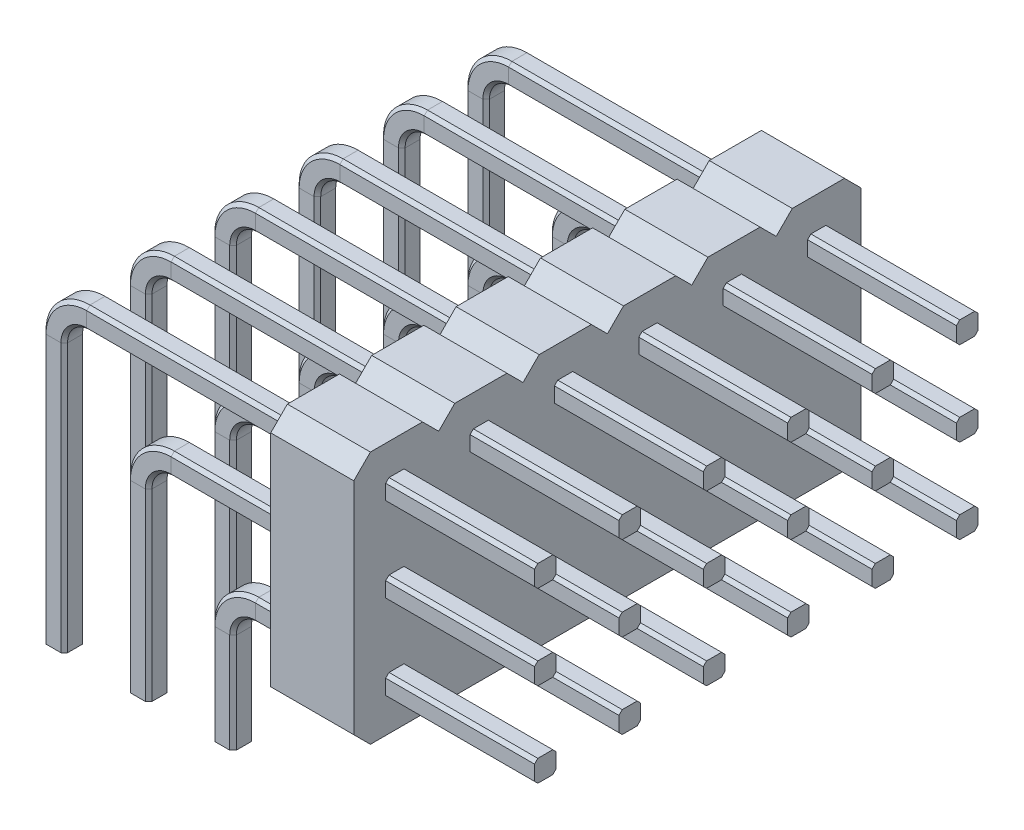
from build123d import *

# Parameters (mm, degrees)
EXTRUDE_1_DEPTH        = 2.5
PATTERN_LINEAR_1_COUNT = 6
PATTERN_LINEAR_1_PITCH = 2.54


with BuildPart() as part:
    # 扫描8: sweep along a path in 草图2
    with BuildLine(Plane.XY) as sweep_8_path:
        Line((5.08, 0), (5.08, 3))
        ThreePointArc((5.08, 3), (5.372893219, 3.707106781), (6.08, 4))
        Line((6.08, 4), (14.48, 4))
    # 草图1 → 扫描8 (sweep)
    with BuildSketch(Plane(origin=(0, 0, 0), x_dir=(1, 0, 0), z_dir=(0, 1, 0))):
        Polygon((5.405, -0.225), (5.405, 0.225), (5.305, 0.325), (4.855, 0.325), (4.755, 0.225), (4.755, -0.225), (4.855, -0.325), (5.305, -0.325), align=None)
    sweep(path=sweep_8_path.line)



with BuildPart() as body_2:
    # 扫描9: sweep along a path in 草图2<3>
    with BuildLine(Plane.XY) as sweep_9_path:
        Line((2.54, 0), (2.54, 5.54))
        ThreePointArc((2.54, 5.54), (2.832893219, 6.247106781), (3.54, 6.54))
        Line((3.54, 6.54), (14.48, 6.54))
    # 草图1<8> → 扫描9 (sweep)
    with BuildSketch(Plane(origin=(0, 0, 0), x_dir=(1, 0, 0), z_dir=(0, 1, 0))):
        Polygon((2.865, -0.225), (2.865, 0.225), (2.765, 0.325), (2.315, 0.325), (2.215, 0.225), (2.215, -0.225), (2.315, -0.325), (2.765, -0.325), align=None)
    sweep(path=sweep_9_path.line)


with BuildPart() as body_3:
    # 扫描10: sweep along a path in 草图2<4>
    with BuildLine(Plane.XY) as sweep_10_path:
        Line((0, 0), (0, 8.08))
        ThreePointArc((0, 8.08), (0.292893219, 8.787106781), (1, 9.08))
        Line((1, 9.08), (14.48, 9.08))
    # 草图1<9> → 扫描10 (sweep)
    with BuildSketch(Plane(origin=(0, 0, 0), x_dir=(1, 0, 0), z_dir=(0, 1, 0))):
        Polygon((-0.225, 0.325), (-0.325, 0.225), (-0.325, -0.225), (-0.225, -0.325), (0.225, -0.325), (0.325, -0.225), (0.325, 0.225), (0.225, 0.325), align=None)
    sweep(path=sweep_10_path.line)


with BuildPart() as part_1:
    add(part.part)

    add(body_2.part)  # 凸台-拉伸1 merges body 2

    add(body_3.part)  # 凸台-拉伸1 merges body 3
    # 草图9 → 凸台-拉伸1 (add)
    with BuildSketch(Plane(origin=(7.5, 0, 0), x_dir=(0, 0, -1), z_dir=(1, 0, 0))):
        Polygon((0.785, 2.73), (-0.785, 2.73), (-1.285, 3.23), (-1.285, 9.85), (-0.785, 10.35), (0.785, 10.35), (1.285, 9.85), (1.285, 3.23), align=None)
    extrude(amount=EXTRUDE_1_DEPTH)


with BuildPart() as pattern_linear_1_1:
    # 阵列(线性)1: pattern copy
    add(part_1.part.moved(Location(Vector(0, 0, -1) * (1 * PATTERN_LINEAR_1_PITCH))))


with BuildPart() as pattern_linear_1_2:
    # 阵列(线性)1: pattern copy
    add(part_1.part.moved(Location(Vector(0, 0, -1) * (2 * PATTERN_LINEAR_1_PITCH))))


with BuildPart() as pattern_linear_1_3:
    # 阵列(线性)1: pattern copy
    add(part_1.part.moved(Location(Vector(0, 0, -1) * (3 * PATTERN_LINEAR_1_PITCH))))


with BuildPart() as pattern_linear_1_4:
    # 阵列(线性)1: pattern copy
    add(part_1.part.moved(Location(Vector(0, 0, -1) * (4 * PATTERN_LINEAR_1_PITCH))))


with BuildPart() as pattern_linear_1_5:
    # 阵列(线性)1: pattern copy
    add(part_1.part.moved(Location(Vector(0, 0, -1) * (5 * PATTERN_LINEAR_1_PITCH))))


with BuildPart() as part_2:
    add(part_1.part)

    # Combine 1: union 阵列(线性)1_1, 阵列(线性)1_2, 阵列(线性)1_4, 阵列(线性)1_3, 阵列(线性)1_5
    add(pattern_linear_1_1.part)
    add(pattern_linear_1_2.part)
    add(pattern_linear_1_4.part)
    add(pattern_linear_1_3.part)
    add(pattern_linear_1_5.part)


solid = part_2.part
